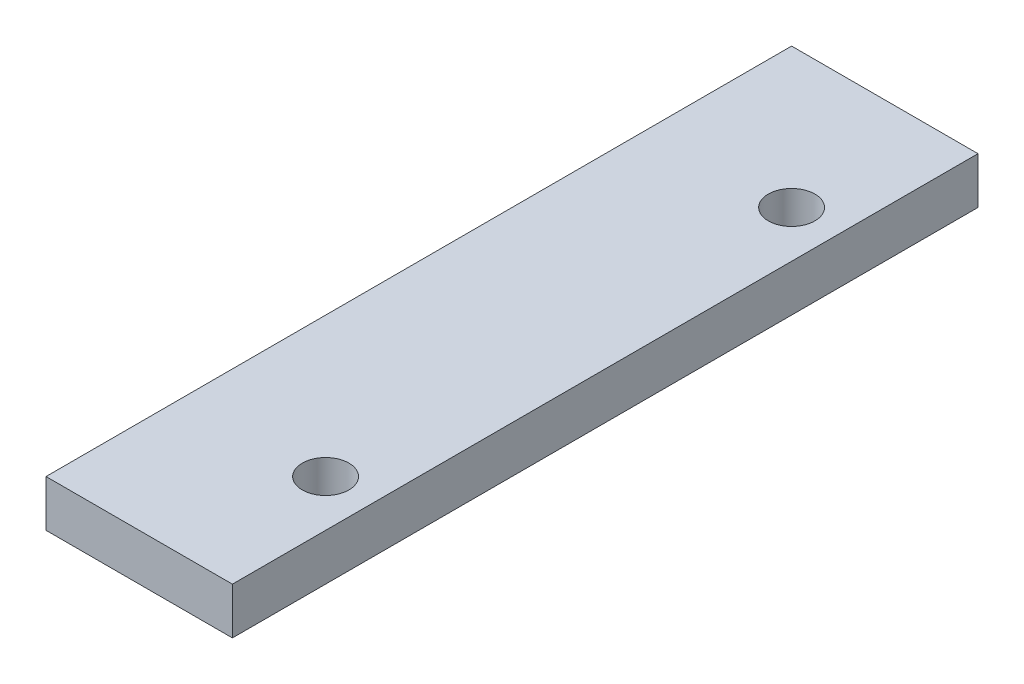
from build123d import *

# Parameters (mm, degrees)
SKETCH1_W                   = 25.4
SKETCH1_H                   = 101.6
BOSS_EXTRUDE1_DEPTH         = 3.175
F_1_4_0_25_DIAMETER_HOLE1_D = 6.35


with BuildPart() as part:
    # Sketch1 → Boss-Extrude1 (new, symmetric)
    with BuildSketch(Plane(origin=(0, 0, 0), x_dir=(1, 0, 0), z_dir=(0, 1, 0))):
        Rectangle(SKETCH1_W, SKETCH1_H)
    extrude(amount=BOSS_EXTRUDE1_DEPTH, both=True)

    # 1/4 (0.25) Diameter Hole1 (through all)
    with Locations(Plane(origin=(0, 3.175, 0), x_dir=(1, 0, 0), z_dir=(0, 1, 0))):
        with Locations((6.35, -31.75), (6.35, 31.75)):
            Hole(F_1_4_0_25_DIAMETER_HOLE1_D / 2)


solid = part.part
